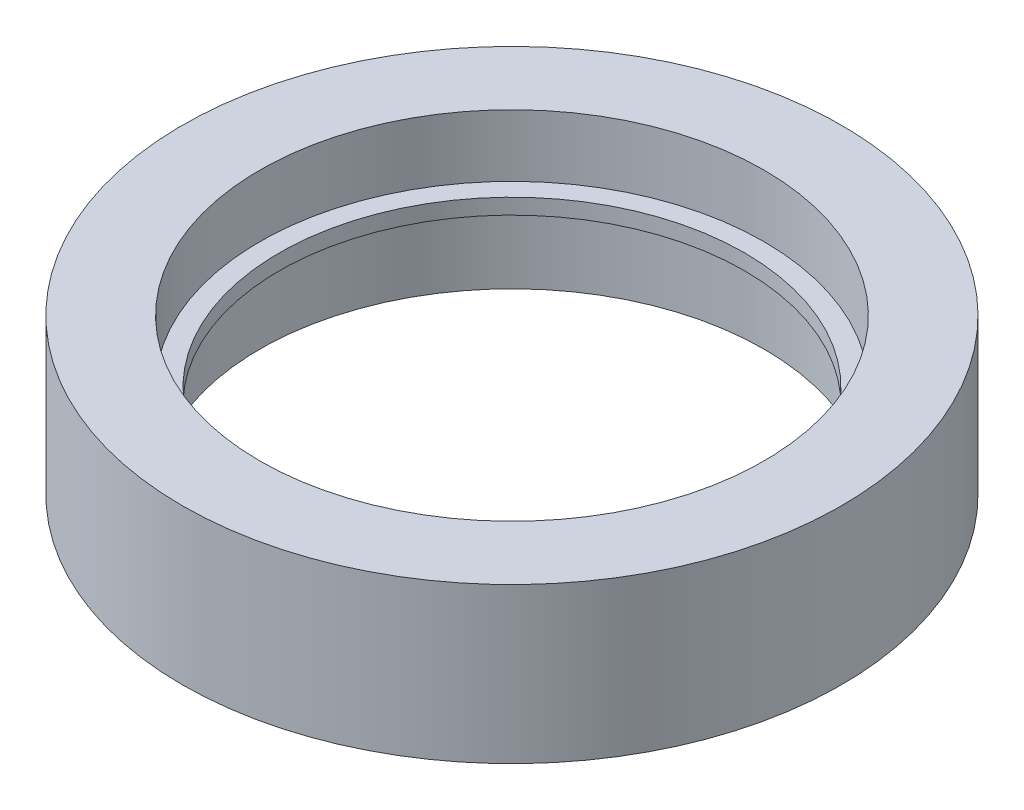
from build123d import *

# Parameters (mm, degrees)
SKETCH1_R           = 42.5
SKETCH1_R_2         = 32.5
BOSS_EXTRUDE1_DEPTH = 20
SKETCH2_R           = 33
SKETCH2_R_2         = 30
BOSS_EXTRUDE2_DEPTH = 2


with BuildPart() as part:
    # Sketch1 → Boss-Extrude1 (new body)
    with BuildSketch(Plane(origin=(0, 0, 0), x_dir=(1, 0, 0), z_dir=(0, 1, 0))):
        with Locations(Location((0, 0, 0), (0, 0, 270))):
            Circle(SKETCH1_R)
        with Locations(Location((0, 0, 0), (0, 0, 270))):
            Circle(SKETCH1_R_2, mode=Mode.SUBTRACT)
    extrude(amount=BOSS_EXTRUDE1_DEPTH)

    # Sketch2 → Boss-Extrude2 (add)
    with BuildSketch(Plane(origin=(0, 10, 0), x_dir=(1, 0, 0), z_dir=(0, 1, 0))):
        Circle(SKETCH2_R)
        with Locations(Location((0, 0, 0), (0, 0, 270))):
            Circle(SKETCH2_R_2, mode=Mode.SUBTRACT)
    extrude(amount=BOSS_EXTRUDE2_DEPTH)


solid = part.part
